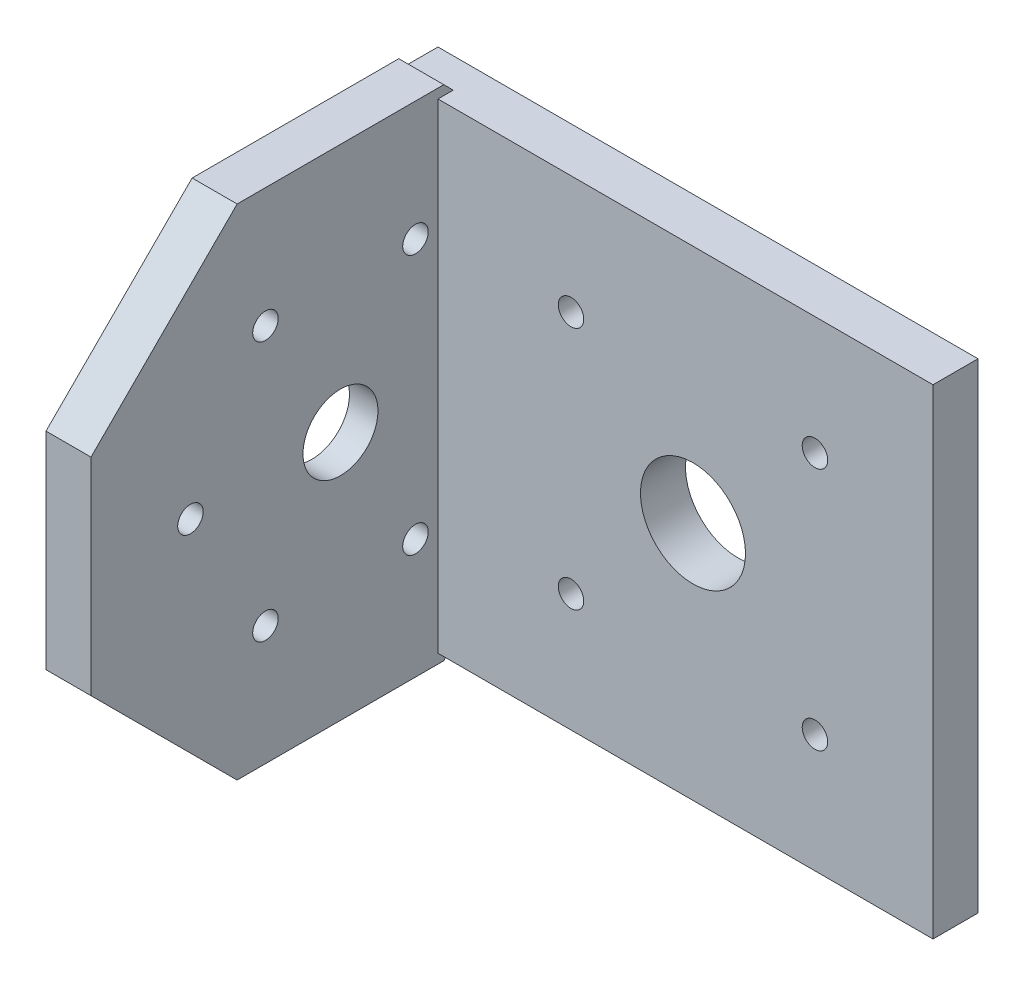
from build123d import *

# Parameters (mm, degrees)
SK_ROLL_PLATE_R         = 1.7
SK_ROLL_PLATE_R_2       = 5
ROLL_PLATE_DEPTH        = 6
SK_YAW_PLATE_W          = 72
SK_YAW_PLATE_H          = 64
SK_YAW_PLATE_R          = 1.7
SK_YAW_PLATE_R_2        = 7
YAW_PLATE_DEPTH         = 6
SK_ROLL_PILOT_RECESS_R  = 15.15
ROLL_PILOT_RECESS_DEPTH = 2.2


with BuildPart() as part:
    # SK_Roll_Plate → Roll_Plate (new body)
    with BuildSketch(Plane(origin=(-40, 0, 0), x_dir=(0, 0, -1), z_dir=(1, 0, 0))):
        Polygon((-13.776603565, 33.25966317), (-33.25966317, 13.776603565), (-33.25966317, -13.776603565), (-13.776603565, -33.25966317), (13.776603565, -33.25966317), (33.25966317, -13.776603565), (33.25966317, 13.776603565), (13.776603565, 33.25966317), align=None)
        with Locations((20, 0)):
            Circle(SK_ROLL_PLATE_R, mode=Mode.SUBTRACT)
        with Locations((10, 17.320508076)):
            Circle(SK_ROLL_PLATE_R, mode=Mode.SUBTRACT)
        with Locations((-10, 17.320508076)):
            Circle(SK_ROLL_PLATE_R, mode=Mode.SUBTRACT)
        with Locations((-20, 0)):
            Circle(SK_ROLL_PLATE_R, mode=Mode.SUBTRACT)
        with Locations((-10, -17.320508076)):
            Circle(SK_ROLL_PLATE_R, mode=Mode.SUBTRACT)
        with Locations((10, -17.320508076)):
            Circle(SK_ROLL_PLATE_R, mode=Mode.SUBTRACT)
        Circle(SK_ROLL_PLATE_R_2, mode=Mode.SUBTRACT)
    extrude(amount=ROLL_PLATE_DEPTH)

    # SK_Yaw_Plate → Yaw_Plate (add)
    with BuildSketch(Plane.XY.offset(-19)):
        with Locations((-4, 0)):
            Rectangle(SK_YAW_PLATE_W, SK_YAW_PLATE_H)
        with Locations((16.263455967, 16.263455967)):
            Circle(SK_YAW_PLATE_R, mode=Mode.SUBTRACT)
        with Locations((-16.263455967, 16.263455967)):
            Circle(SK_YAW_PLATE_R, mode=Mode.SUBTRACT)
        with Locations((-16.263455967, -16.263455967)):
            Circle(SK_YAW_PLATE_R, mode=Mode.SUBTRACT)
        with Locations((16.263455967, -16.263455967)):
            Circle(SK_YAW_PLATE_R, mode=Mode.SUBTRACT)
        Circle(SK_YAW_PLATE_R_2, mode=Mode.SUBTRACT)
    extrude(amount=YAW_PLATE_DEPTH)

    # SK_Roll_Pilot_Recess → Roll_Pilot_Recess (cut)
    with BuildSketch(Plane(origin=(-40, 0, 0), x_dir=(0, 0, -1), z_dir=(1, 0, 0))):
        Circle(SK_ROLL_PILOT_RECESS_R)
    extrude(amount=ROLL_PILOT_RECESS_DEPTH, mode=Mode.SUBTRACT)


solid = part.part
